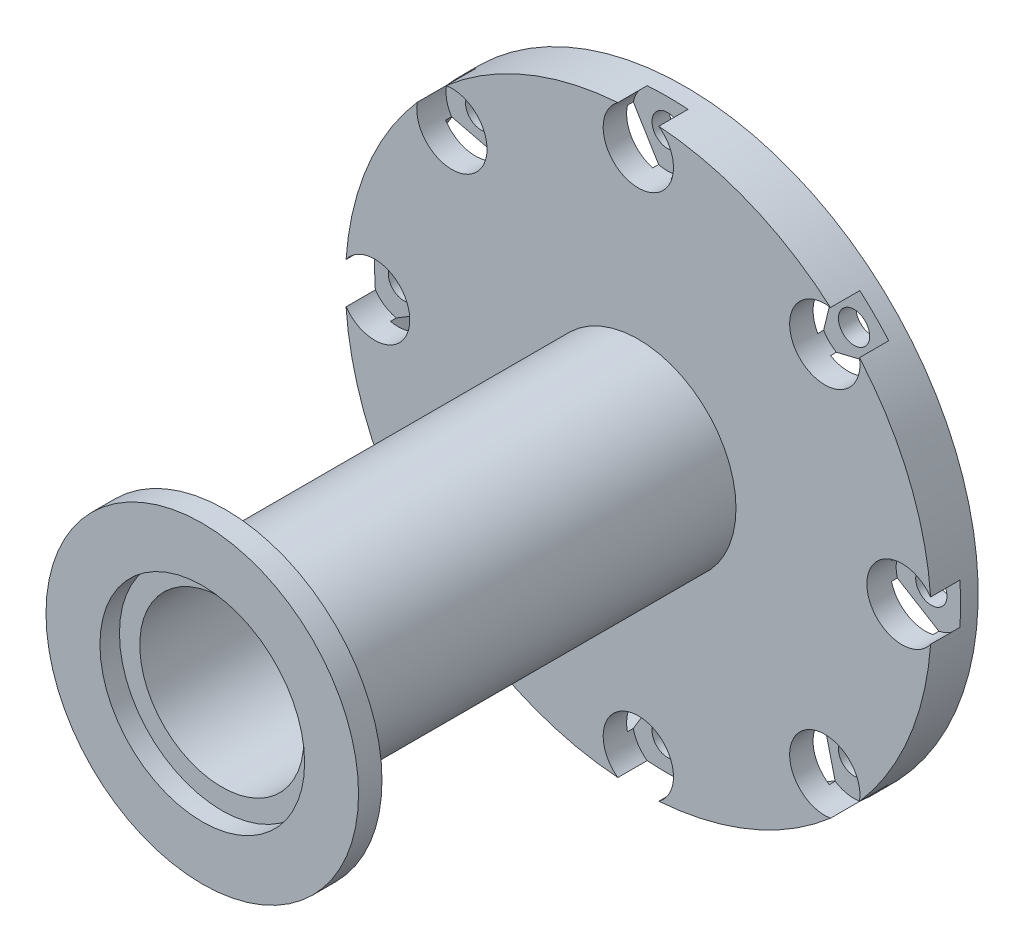
from build123d import *

# Parameters (mm, degrees)
SKETCH2_R           = 37.5
SKETCH2_R_2         = 5.35
BOSS_EXTRUDE2_DEPTH = 8
SKETCH14_R          = 2
CUT_EXTRUDE6_DEPTH  = 54.633012222
SKETCH3_R           = 20.71
CUT_EXTRUDE2_DEPTH  = 6.5
SKETCH7_R           = 12.5
SKETCH7_R_2         = 10.5
BOSS_EXTRUDE4_DEPTH = 50.8
SKETCH10_R          = 12.5
BOSS_EXTRUDE5_DEPTH = 2.01
BOSS_EXTRUDE5_DRAFT = -75
SKETCH11_R          = 10.5
CUT_EXTRUDE3_DEPTH  = 81.686777727
BOSS_EXTRUDE6_START = 3
SKETCH12_R          = 20.001422123
SKETCH12_R_2        = 10.5
BOSS_EXTRUDE6_DEPTH = 3
SKETCH13_R          = 13.1
CUT_EXTRUDE4_DEPTH  = 2.5
SKETCH17_R          = 4.5
CUT_EXTRUDE8_DEPTH  = 3.75
SKETCH18_R          = 37.5
CUT_EXTRUDE9_DEPTH  = 2
SKETCH19_R          = 27.5
CUT_EXTRUDE10_DEPTH = 3
CUT_EXTRUDE11_DEPTH = 3


with BuildPart() as part:
    # Sketch2 → Boss-Extrude2 (new body)
    with BuildSketch(Plane.XY):
        Circle(SKETCH2_R)
        Circle(SKETCH2_R_2, mode=Mode.SUBTRACT)
    extrude(amount=BOSS_EXTRUDE2_DEPTH)

    # Sketch14 → Cut-Extrude6 (cut, through all)
    with BuildSketch(Plane.XY):
        with Locations((0, 33.75)):
            Circle(SKETCH14_R)
        with Locations((-23.864853865, 23.864853865)):
            Circle(SKETCH14_R)
        with Locations((-33.75, 0)):
            Circle(SKETCH14_R)
        with Locations((-23.864853865, -23.864853865)):
            Circle(SKETCH14_R)
        with Locations((0, -33.75)):
            Circle(SKETCH14_R)
        with Locations((23.864853865, -23.864853865)):
            Circle(SKETCH14_R)
        with Locations((33.75, 0)):
            Circle(SKETCH14_R)
        with Locations((23.864853865, 23.864853865)):
            Circle(SKETCH14_R)
    extrude(amount=CUT_EXTRUDE6_DEPTH, mode=Mode.SUBTRACT)

    # Sketch3 → Cut-Extrude2 (cut)
    with BuildSketch(Plane.XY):
        with Locations(Location((0, 0, 0), (0, 0, 180))):
            Circle(SKETCH3_R)
    extrude(amount=CUT_EXTRUDE2_DEPTH, mode=Mode.SUBTRACT)

    # Sketch7 → Boss-Extrude4 (add)
    with BuildSketch(Plane.XY.offset(8)):
        Circle(SKETCH7_R)
        Circle(SKETCH7_R_2, mode=Mode.SUBTRACT)
    extrude(amount=BOSS_EXTRUDE4_DEPTH)


with BuildPart() as boss_extrude5_tool:
    # Sketch10 → Boss-Extrude5 (with draft: the straight prism first)
    with BuildSketch(Plane.XY.offset(58.8)):
        Circle(SKETCH10_R)
    extrude(amount=BOSS_EXTRUDE5_DEPTH)
    # Boss-Extrude5: the draft: its side faces are tilted about the plane it starts from
    boss_extrude5_sides = [boss_extrude5_tool.faces().sort_by_distance(p)[0] for p in [
        (-12.5, 0, 59.805),
    ]]
    draft(boss_extrude5_sides, Plane.XY.offset(58.8), BOSS_EXTRUDE5_DRAFT)


with BuildPart() as part_1:
    add(part.part)

    # Boss-Extrude5: add boss_extrude5_tool
    add(boss_extrude5_tool.part)

    # Sketch11 → Cut-Extrude3 (cut, through all)
    with BuildSketch(Plane.XY.offset(60.81)):
        Circle(SKETCH11_R)
    extrude(amount=-CUT_EXTRUDE3_DEPTH, mode=Mode.SUBTRACT)

    # Sketch12 → Boss-Extrude6 (add)
    with BuildSketch(Plane.XY.offset(60.81).offset(BOSS_EXTRUDE6_START)):
        Circle(SKETCH12_R)
        Circle(SKETCH12_R_2, mode=Mode.SUBTRACT)
    extrude(amount=-BOSS_EXTRUDE6_DEPTH)

    # Sketch13 → Cut-Extrude4 (cut)
    with BuildSketch(Plane.XY.offset(63.81)):
        Circle(SKETCH13_R)
    extrude(amount=-CUT_EXTRUDE4_DEPTH, mode=Mode.SUBTRACT)

    # Sketch17 → Cut-Extrude8 (cut)
    with BuildSketch(Plane.XY.offset(8)):
        with Locations((-23.864853865, 23.864853865)):
            Circle(SKETCH17_R)
        with Locations((-33.75, 0)):
            Circle(SKETCH17_R)
        with Locations((0, 33.75)):
            Circle(SKETCH17_R)
        with Locations((23.864853865, 23.864853865)):
            Circle(SKETCH17_R)
        with Locations((33.75, 0)):
            Circle(SKETCH17_R)
        with Locations((23.864853865, -23.864853865)):
            Circle(SKETCH17_R)
        with Locations((0, -33.75)):
            Circle(SKETCH17_R)
        with Locations((-23.864853865, -23.864853865)):
            Circle(SKETCH17_R)
    extrude(amount=-CUT_EXTRUDE8_DEPTH, mode=Mode.SUBTRACT)

    # Sketch18 → Cut-Extrude9 (cut)
    with BuildSketch(Plane(origin=(0, 0, 0), x_dir=(-1, 0, 0), z_dir=(0, 0, -1))):
        Circle(SKETCH18_R)
    extrude(amount=-CUT_EXTRUDE9_DEPTH, mode=Mode.SUBTRACT)

    # Sketch19 → Cut-Extrude10 (cut)
    with BuildSketch(Plane(origin=(0, 0, 2), x_dir=(-1, 0, 0), z_dir=(0, 0, -1))):
        Circle(SKETCH19_R)
    extrude(amount=-CUT_EXTRUDE10_DEPTH, mode=Mode.SUBTRACT)

    # Sketch21 → Cut-Extrude11 (cut)
    with BuildSketch(Plane(origin=(0, 0, 2), x_dir=(-1, 0, 0), z_dir=(0, 0, -1))):
        with BuildLine():
            ThreePointArc((-19.445436483, -19.445436483), (-25.406687144, -10.52379439), (-27.5, 0))
            Line((-27.5, 0), (-35.190042838, -4.680906432))
            ThreePointArc((-35.190042838, -4.680906432), (-32.79655916, -13.588072242), (-28.189320962, -21.578048653))
            Line((-28.189320962, -21.578048653), (-19.445436483, -19.445436483))
        make_face()
        with BuildLine():
            Line((-35.190844537, 4.674875482), (-27.5, 0))
            ThreePointArc((-27.5, 0), (-25.406687144, 10.52379439), (-19.445436483, 19.445436483))
            Line((-19.445436483, 19.445436483), (-28.193018602, 21.573217241))
            ThreePointArc((-28.193018602, 21.573217241), (-32.798887407, 13.582451357), (-35.190844537, 4.674875482))
        make_face()
        with BuildLine():
            Line((-21.578048653, 28.189320962), (-19.445436483, 19.445436483))
            ThreePointArc((-19.445436483, 19.445436483), (-10.52379439, 25.406687144), (0, 27.5))
            Line((0, 27.5), (-4.680906432, 35.190042838))
            ThreePointArc((-4.680906432, 35.190042838), (-13.588072242, 32.79655916), (-21.578048653, 28.189320962))
        make_face()
        with BuildLine():
            Line((4.674875482, 35.190844537), (0, 27.5))
            ThreePointArc((0, 27.5), (10.52379439, 25.406687144), (19.445436483, 19.445436483))
            Line((19.445436483, 19.445436483), (21.573217241, 28.193018602))
            ThreePointArc((21.573217241, 28.193018602), (13.582451357, 32.798887407), (4.674875482, 35.190844537))
        make_face()
        with BuildLine():
            Line((28.189320962, 21.578048653), (19.445436483, 19.445436483))
            ThreePointArc((19.445436483, 19.445436483), (25.406687144, 10.52379439), (27.5, 0))
            Line((27.5, 0), (35.190042838, 4.680906432))
            ThreePointArc((35.190042838, 4.680906432), (32.79655916, 13.588072242), (28.189320962, 21.578048653))
        make_face()
        with BuildLine():
            ThreePointArc((27.5, 0), (25.406687144, -10.52379439), (19.445436483, -19.445436483))
            Line((19.445436483, -19.445436483), (28.193018602, -21.573217241))
            ThreePointArc((28.193018602, -21.573217241), (32.798887407, -13.582451357), (35.190844537, -4.674875482))
            Line((35.190844537, -4.674875482), (27.5, 0))
        make_face()
        with BuildLine():
            ThreePointArc((19.445436483, -19.445436483), (10.52379439, -25.406687144), (0, -27.5))
            Line((0, -27.5), (4.680906432, -35.190042838))
            ThreePointArc((4.680906432, -35.190042838), (13.588072242, -32.79655916), (21.578048653, -28.189320962))
            Line((21.578048653, -28.189320962), (19.445436483, -19.445436483))
        make_face()
        with BuildLine():
            ThreePointArc((0, -27.5), (-10.52379439, -25.406687144), (-19.445436483, -19.445436483))
            Line((-19.445436483, -19.445436483), (-21.573217241, -28.193018602))
            ThreePointArc((-21.573217241, -28.193018602), (-13.582451357, -32.798887407), (-4.674875482, -35.190844537))
            Line((-4.674875482, -35.190844537), (0, -27.5))
        make_face()
    extrude(amount=-CUT_EXTRUDE11_DEPTH, mode=Mode.SUBTRACT)


solid = part_1.part
